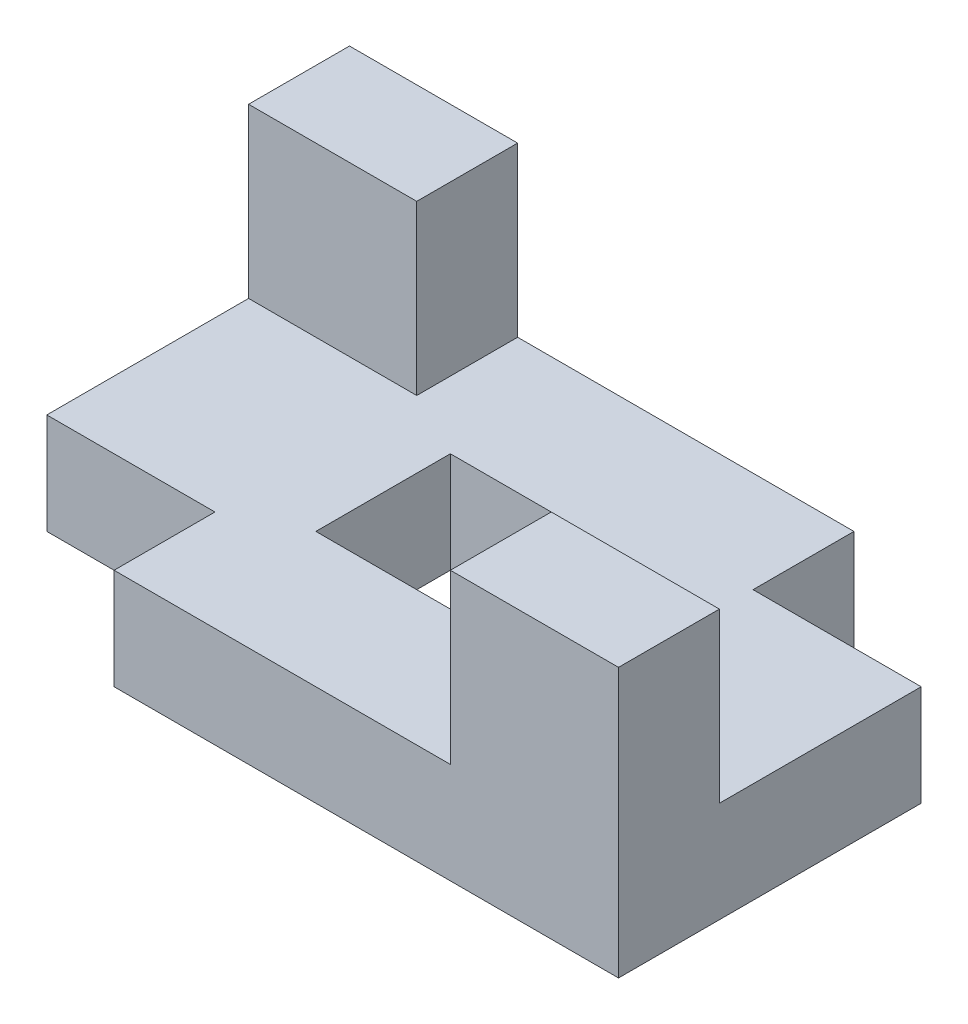
from build123d import *

# Parameters (mm, degrees)
SKETCH1_W           = 100
SKETCH1_H           = 60
BOSS_EXTRUDE1_DEPTH = 15
SKETCH2_W           = 25
SKETCH2_H           = 15
BOSS_EXTRUDE3_DEPTH = 25
SKETCH2_4_W         = 25
SKETCH2_4_H         = 15
BOSS_EXTRUDE4_DEPTH = 25
SKETCH9_W           = 25
SKETCH9_H           = 15
CUT_EXTRUDE1_DEPTH  = 100
SKETCH9_3_W         = 25
SKETCH9_3_H         = 15
CUT_EXTRUDE2_DEPTH  = 100
SKETCH11_W          = 30
SKETCH11_H          = 20
CUT_EXTRUDE3_DEPTH  = 100


with BuildPart() as part:
    # Sketch1 → Boss-Extrude1 (new body)
    with BuildSketch(Plane(origin=(0, 0, 0), x_dir=(1, 0, 0), z_dir=(0, 1, 0))):
        Rectangle(SKETCH1_W, SKETCH1_H)
    extrude(amount=BOSS_EXTRUDE1_DEPTH)

    # Sketch2 → Boss-Extrude3 (add)
    with BuildSketch(Plane(origin=(0, 15, 0), x_dir=(1, 0, 0), z_dir=(0, 1, 0))):
        with Locations((-37.5, 22.5)):
            Rectangle(SKETCH2_W, SKETCH2_H)
    extrude(amount=BOSS_EXTRUDE3_DEPTH)

    # Sketch2<4> → Boss-Extrude4 (add)
    with BuildSketch(Plane(origin=(0, 15, 0), x_dir=(1, 0, 0), z_dir=(0, 1, 0))):
        with Locations((-37.5, 22.5)):
            Rectangle(SKETCH2_4_W, SKETCH2_4_H)
        with Locations((37.5, -22.5)):
            Rectangle(SKETCH2_4_W, SKETCH2_4_H)
    extrude(amount=BOSS_EXTRUDE4_DEPTH)

    # Sketch9 → Cut-Extrude1 (cut)
    with BuildSketch(Plane(origin=(0, 15, 0), x_dir=(1, 0, 0), z_dir=(0, 1, 0))):
        with Locations((-37.5, -22.5)):
            Rectangle(SKETCH9_W, SKETCH9_H)
    extrude(amount=-CUT_EXTRUDE1_DEPTH, mode=Mode.SUBTRACT)

    # Sketch9<3> → Cut-Extrude2 (cut)
    with BuildSketch(Plane(origin=(0, 15, 0), x_dir=(1, 0, 0), z_dir=(0, 1, 0))):
        with Locations((-37.5, -22.5)):
            Rectangle(SKETCH9_3_W, SKETCH9_3_H)
        with Locations((37.5, 22.5)):
            Rectangle(SKETCH9_3_W, SKETCH9_3_H)
    extrude(amount=-CUT_EXTRUDE2_DEPTH, mode=Mode.SUBTRACT)

    # Sketch11 → Cut-Extrude3 (cut)
    with BuildSketch(Plane(origin=(0, 15, 0), x_dir=(1, 0, 0), z_dir=(0, 1, 0))):
        Rectangle(SKETCH11_W, SKETCH11_H)
    extrude(amount=-CUT_EXTRUDE3_DEPTH, mode=Mode.SUBTRACT)


solid = part.part
